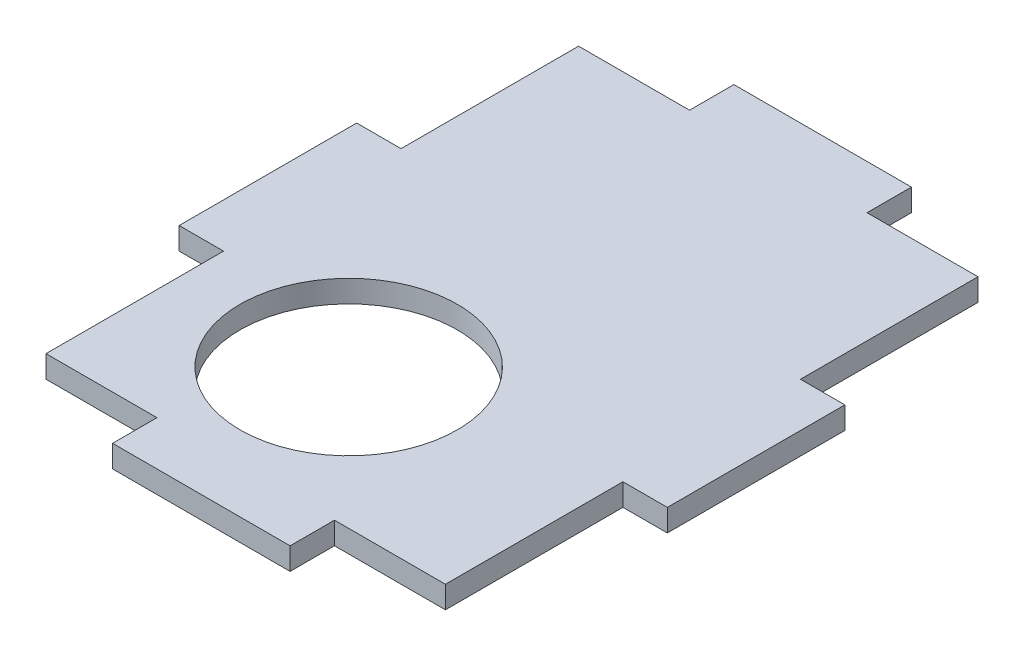
from build123d import *

# Parameters (mm, degrees)
SKETCH1_W           = 90
SKETCH1_H           = 120
SKETCH1_R           = 24.5
SKETCH1_W_2         = 10
SKETCH1_H_2         = 40
SKETCH1_W_3         = 40
SKETCH1_H_3         = 10
BOSS_EXTRUDE1_DEPTH = 5


with BuildPart() as part:
    # Sketch1 → Boss-Extrude1 (new body)
    # profile 1 of 5: a face of its own
    with BuildSketch(Plane(origin=(0, 0, 0), x_dir=(1, 0, 0), z_dir=(0, 1, 0))):
        with Locations((45, 60)):
            Rectangle(SKETCH1_W, SKETCH1_H)
        with Locations(Location((36.72, 31.48, 0), (0, 0, 270))):
            Circle(SKETCH1_R, mode=Mode.SUBTRACT)
    # profile 2 of 5: a face of its own
    with BuildSketch(Plane(origin=(0, 0, 0), x_dir=(1, 0, 0), z_dir=(0, 1, 0))):
        with Locations((-5, 60)):
            Rectangle(SKETCH1_W_2, SKETCH1_H_2)
    # profile 3 of 5: a face of its own
    with BuildSketch(Plane(origin=(0, 0, 0), x_dir=(1, 0, 0), z_dir=(0, 1, 0))):
        with Locations((45, 125)):
            Rectangle(SKETCH1_W_3, SKETCH1_H_3)
    # profile 4 of 5: a face of its own
    with BuildSketch(Plane(origin=(0, 0, 0), x_dir=(1, 0, 0), z_dir=(0, 1, 0))):
        with Locations((95, 60)):
            Rectangle(SKETCH1_W_2, SKETCH1_H_2)
    # profile 5 of 5: a face of its own
    with BuildSketch(Plane(origin=(0, 0, 0), x_dir=(1, 0, 0), z_dir=(0, 1, 0))):
        with Locations((45, -5)):
            Rectangle(SKETCH1_W_3, SKETCH1_H_3)
    extrude(amount=BOSS_EXTRUDE1_DEPTH)


solid = part.part
